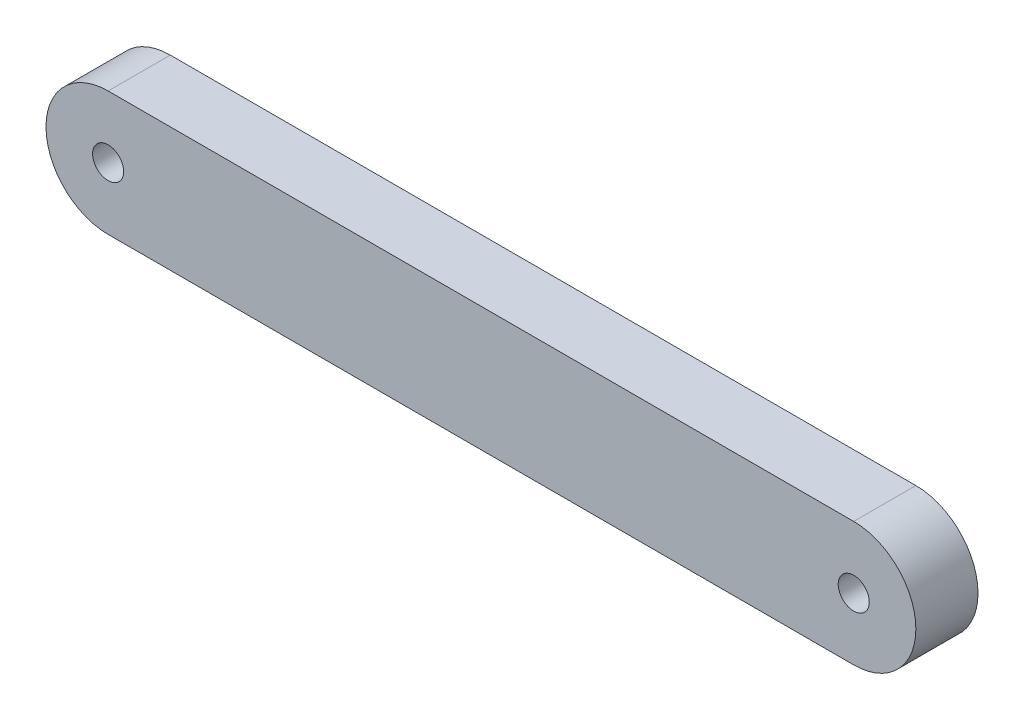
from build123d import *

# Parameters (mm, degrees)
SKETCH1_R           = 6.35
SKETCH1_R_2         = 1.5875
BOSS_EXTRUDE1_DEPTH = 6.35


with BuildPart() as part:
    # Sketch1 → Boss-Extrude1 (new body)
    # profile 1 of 3: a face of its own
    with BuildSketch(Plane.XY):
        with BuildLine():
            Line((76.2, 6.35), (0, 6.35))
            ThreePointArc((0, 6.35), (4.490128061, 4.490128061), (6.35, 0))
            ThreePointArc((6.35, 0), (4.490128061, -4.490128061), (0, -6.35))
            Line((0, -6.35), (76.2, -6.35))
            ThreePointArc((76.2, -6.35), (69.85, 0), (76.2, 6.35))
        make_face()
    # profile 2 of 3: a face of its own
    with BuildSketch(Plane.XY):
        Circle(SKETCH1_R)
        Circle(SKETCH1_R_2, mode=Mode.SUBTRACT)
    # profile 3 of 3: a face of its own
    with BuildSketch(Plane.XY):
        with Locations((76.2, 0)):
            Circle(SKETCH1_R)
        with Locations((76.2, 0)):
            Circle(SKETCH1_R_2, mode=Mode.SUBTRACT)
    extrude(amount=BOSS_EXTRUDE1_DEPTH)


solid = part.part
